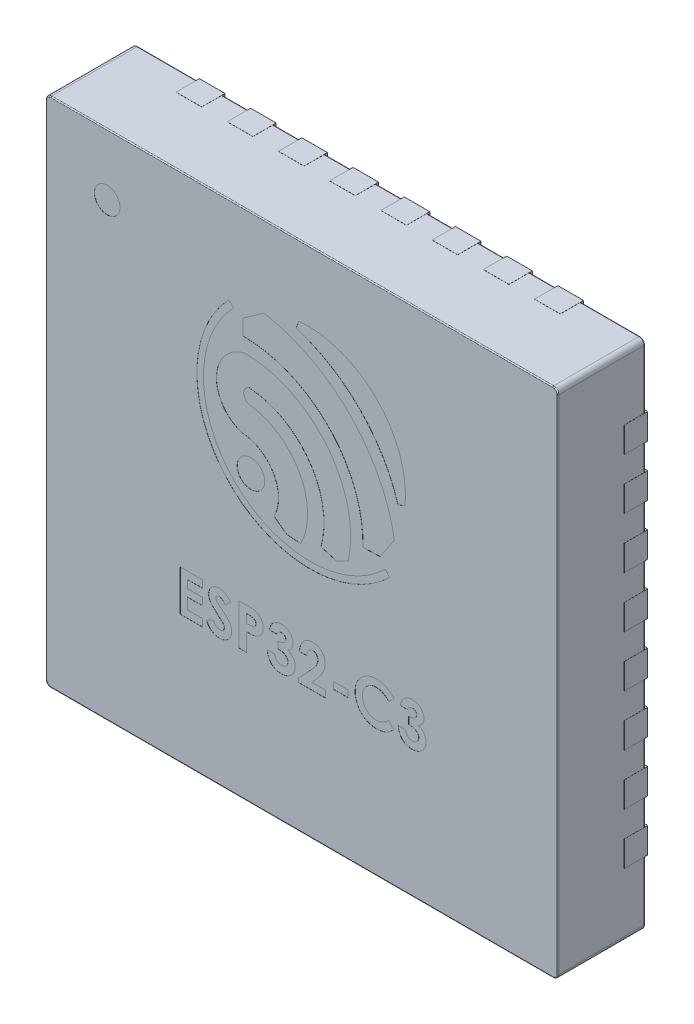
from build123d import *

# Parameters (mm, degrees)
SKETCH1_W                = 5
SKETCH1_H                = 5
BOSS_EXTRUDE1_DEPTH      = 0.85
FILLET1_R                = 0.05
FILLET2_R                = 0.01
BOSS_EXTRUDE2_DEPTH      = 0.025
BOSS_EXTRUDE2_DEPTH_BACK = 0.203
SKETCH2_W                = 0.25
SKETCH2_H                = 0.4
SKETCH2_W_2              = 0.4
SKETCH2_H_2              = 0.25
SKETCH3_R                = 0.125
SKETCH3_R_2              = 0.134340001
SKETCH3_W                = 0.138461539
SKETCH3_H                = 0.066666666
CUT_EXTRUDE1_DEPTH       = 0.001
BODY_MOVE_COPY1_ANGLE    = 180


with BuildPart() as part:
    # Sketch1 → Boss-Extrude1 (new body)
    with BuildSketch(Plane(origin=(0, 0, 0), x_dir=(1, 0, 0), z_dir=(0, 1, 0))):
        Rectangle(SKETCH1_W, SKETCH1_H)
    extrude(amount=BOSS_EXTRUDE1_DEPTH)

    # Fillet1
    fillet1_edges = [part.edges().sort_by_distance(p)[0] for p in [
        (2.5, 0.425, 2.5),
        (-2.5, 0.425, 2.5),
        (-2.5, 0.425, -2.5),
        (2.5, 0.425, -2.5),
    ]]
    fillet(fillet1_edges, radius=FILLET1_R)

    # Fillet2
    fillet2_edges = [part.edges().sort_by_distance(p)[0] for p in [
        (0, 0, -2.5),
        (0, 0.85, -2.5),
        (2.5, 0, 0),
        (0, 0, 2.5),
        (-2.5, 0, 0),
        (-2.485355339, 0, -2.485355339),
        (-2.485355339, 0, 2.485355339),
        (2.485355339, 0, 2.485355339),
        (2.485355339, 0, -2.485355339),
        (2.5, 0.85, 0),
        (-2.5, 0.85, 0),
        (0, 0.85, 2.5),
        (-2.485355339, 0.85, -2.485355339),
        (-2.485355339, 0.85, 2.485355339),
        (2.485355339, 0.85, 2.485355339),
        (2.485355339, 0.85, -2.485355339),
    ]]
    fillet(fillet2_edges, radius=FILLET2_R)

    # Sketch2 → Boss-Extrude2 (add, two sides: drawn at the far end of the back side and taken through both)
    with BuildSketch(Plane.XZ.offset(-BOSS_EXTRUDE2_DEPTH_BACK)):
        with BuildLine():
            Line((1.55732233, 1.84267767), (1.84267767, 1.55732233))
            ThreePointArc((1.84267767, 1.55732233), (1.848096988, 1.549211747), (1.85, 1.539644661))
            Line((1.85, 1.539644661), (1.85, -1.825))
            ThreePointArc((1.85, -1.825), (1.84267767, -1.84267767), (1.825, -1.85))
            Line((1.825, -1.85), (-1.825, -1.85))
            ThreePointArc((-1.825, -1.85), (-1.84267767, -1.84267767), (-1.85, -1.825))
            Line((-1.85, -1.825), (-1.85, 1.825))
            ThreePointArc((-1.85, 1.825), (-1.84267767, 1.84267767), (-1.825, 1.85))
            Line((-1.825, 1.85), (1.539644661, 1.85))
            ThreePointArc((1.539644661, 1.85), (1.549211747, 1.848096988), (1.55732233, 1.84267767))
        make_face()
        with Locations((-0.25, 2.301)):
            Rectangle(SKETCH2_W, SKETCH2_H)
        with Locations((-0.75, 2.301)):
            Rectangle(SKETCH2_W, SKETCH2_H)
        with Locations((-1.25, 2.301)):
            Rectangle(SKETCH2_W, SKETCH2_H)
        with Locations((-1.75, 2.301)):
            Rectangle(SKETCH2_W, SKETCH2_H)
        with Locations((1.75, 2.301)):
            Rectangle(SKETCH2_W, SKETCH2_H)
        with Locations((1.25, 2.301)):
            Rectangle(SKETCH2_W, SKETCH2_H)
        with Locations((0.75, 2.301)):
            Rectangle(SKETCH2_W, SKETCH2_H)
        with Locations((0.25, 2.301)):
            Rectangle(SKETCH2_W, SKETCH2_H)
        with Locations((0.25, -2.301)):
            Rectangle(SKETCH2_W, SKETCH2_H)
        with Locations((0.75, -2.301)):
            Rectangle(SKETCH2_W, SKETCH2_H)
        with Locations((1.25, -2.301)):
            Rectangle(SKETCH2_W, SKETCH2_H)
        with Locations((1.75, -2.301)):
            Rectangle(SKETCH2_W, SKETCH2_H)
        with Locations((-1.75, -2.301)):
            Rectangle(SKETCH2_W, SKETCH2_H)
        with Locations((-1.25, -2.301)):
            Rectangle(SKETCH2_W, SKETCH2_H)
        with Locations((-0.75, -2.301)):
            Rectangle(SKETCH2_W, SKETCH2_H)
        with Locations((-0.25, -2.301)):
            Rectangle(SKETCH2_W, SKETCH2_H)
        with Locations((2.301, 0.25)):
            Rectangle(SKETCH2_W_2, SKETCH2_H_2)
        with Locations((2.301, 0.75)):
            Rectangle(SKETCH2_W_2, SKETCH2_H_2)
        with Locations((2.301, 1.25)):
            Rectangle(SKETCH2_W_2, SKETCH2_H_2)
        with Locations((2.301, 1.75)):
            Rectangle(SKETCH2_W_2, SKETCH2_H_2)
        with Locations((2.301, -1.75)):
            Rectangle(SKETCH2_W_2, SKETCH2_H_2)
        with Locations((2.301, -1.25)):
            Rectangle(SKETCH2_W_2, SKETCH2_H_2)
        with Locations((2.301, -0.75)):
            Rectangle(SKETCH2_W_2, SKETCH2_H_2)
        with Locations((2.301, -0.25)):
            Rectangle(SKETCH2_W_2, SKETCH2_H_2)
        with Locations((-2.301, -0.25)):
            Rectangle(SKETCH2_W_2, SKETCH2_H_2)
        with Locations((-2.301, -0.75)):
            Rectangle(SKETCH2_W_2, SKETCH2_H_2)
        with Locations((-2.301, -1.25)):
            Rectangle(SKETCH2_W_2, SKETCH2_H_2)
        with Locations((-2.301, -1.75)):
            Rectangle(SKETCH2_W_2, SKETCH2_H_2)
        with Locations((-2.301, 1.75)):
            Rectangle(SKETCH2_W_2, SKETCH2_H_2)
        with Locations((-2.301, 1.25)):
            Rectangle(SKETCH2_W_2, SKETCH2_H_2)
        with Locations((-2.301, 0.75)):
            Rectangle(SKETCH2_W_2, SKETCH2_H_2)
        with Locations((-2.301, 0.25)):
            Rectangle(SKETCH2_W_2, SKETCH2_H_2)
    extrude(amount=BOSS_EXTRUDE2_DEPTH + BOSS_EXTRUDE2_DEPTH_BACK)

    # Sketch3 → Cut-Extrude1 (cut)
    # profile 1 of 14: a face of its own
    with BuildSketch(Plane(origin=(0, 0.85, 0), x_dir=(1, 0, 0), z_dir=(0, 1, 0))):
        with Locations(Location((1.9, -1.9, 0), (0, 0, 270))):
            Circle(SKETCH3_R)
    # profile 2 of 14: a face of its own
    with BuildSketch(Plane(origin=(0, 0.85, 0), x_dir=(1, 0, 0), z_dir=(0, 1, 0))):
        with Locations(Location((0.496495742, -0.288773597, 0), (0, 0, 270))):
            Circle(SKETCH3_R_2)
    # profile 3 of 14: a face of its own
    with BuildSketch(Plane(origin=(0, 0.85, 0), x_dir=(1, 0, 0), z_dir=(0, 1, 0))):
        with BuildLine():
            Line((-0.938884258, -0.740862042), (-1.007914258, -0.770262042))
            ThreePointArc((-1.007914258, -0.770262042), (-0.731977732, -1.532346858), (0.028674412, -1.812208514))
            Line((0.028674412, -1.812208514), (0.054985742, -1.738872042))
            ThreePointArc((0.054985742, -1.738872042), (-0.566371663, -1.363773312), (-0.938884258, -0.740862042))
        make_face()
    # profile 4 of 14: a face of its own
    with BuildSketch(Plane(origin=(0, 0.85, 0), x_dir=(1, 0, 0), z_dir=(0, 1, 0))):
        with BuildLine():
            Line((-0.595984259, -0.210971238), (-0.766114259, -0.218261238))
            Line((-0.766114259, -0.218261238), (-0.903604259, -0.428171238))
            ThreePointArc((-0.903604259, -0.428171238), (-0.469528196, -1.269267805), (0.368267697, -1.709680686))
            Line((0.368267697, -1.709680686), (0.574667697, -1.564870686))
            Line((0.574667697, -1.564870686), (0.574667697, -1.412740686))
            ThreePointArc((0.574667697, -1.412740686), (-0.264532199, -1.059156307), (-0.595984259, -0.210971238))
        make_face()
    # profile 5 of 14: a face of its own
    with BuildSketch(Plane(origin=(0, 0.85, 0), x_dir=(1, 0, 0), z_dir=(0, 1, 0))):
        with BuildLine():
            Line((0.665095742, -1.605372042), (0.713185742, -1.647912042))
            ThreePointArc((0.713185742, -1.647912042), (0.698213309, -0.092994976), (-0.856767159, -0.087798687))
            Line((-0.856767159, -0.087798687), (-0.81400017, -0.135693763))
            ThreePointArc((-0.81400017, -0.135693763), (0.652967983, -0.13845143), (0.665095742, -1.605372042))
        make_face()
    # profile 6 of 14: a face of its own
    with BuildSketch(Plane(origin=(0, 0.85, 0), x_dir=(1, 0, 0), z_dir=(0, 1, 0))):
        with BuildLine():
            Line((0.270628145, -0.040897858), (0.152248145, 0.048682142))
            Line((0.152248145, 0.048682142), (0.010108145, 0.061192142))
            ThreePointArc((0.010108145, 0.061192142), (0.023063532, -0.533305093), (0.517018452, -0.864369047))
            ThreePointArc((0.517018452, -0.864369047), (0.56730634, -0.935868301), (0.514364466, -1.005425277))
            ThreePointArc((0.514364466, -1.005425277), (-0.073942865, -0.676163273), (-0.186090772, -0.011376216))
            Line((-0.186090772, -0.011376216), (-0.336330772, 0.033353784))
            Line((-0.336330772, 0.033353784), (-0.453378748, -0.025230137))
            ThreePointArc((-0.453378748, -0.025230137), (-0.246890146, -0.892485919), (0.557429228, -1.276986216))
            ThreePointArc((0.557429228, -1.276986216), (0.833401793, -0.944715678), (0.586918034, -0.590018168))
            ThreePointArc((0.586918034, -0.590018168), (0.277806513, -0.402413824), (0.270628145, -0.040897858))
        make_face()
    # profile 7 of 14: a face of its own
    with BuildSketch(Plane(origin=(0, 0.85, 0), x_dir=(1, 0, 0), z_dir=(0, 1, 0))):
        with BuildLine():
            Line((-1.033333333, 0.942435897), (-0.961538462, 0.942435897))
            add(Edge.make_bspline(
                [(-0.961538462, 0.942435897), (-0.962042198, 0.938846343), (-0.963026121, 0.931835054), (-0.965444874, 0.921660172), (-0.968242016, 0.91198461), (-0.971819164, 0.902860293), (-0.975948336, 0.894297058), (-0.980763511, 0.886287242), (-0.986041261, 0.878715897), (-0.99017341, 0.874178624), (-0.992227564, 0.871923077)],
                knots=[0, 0, 0, 0, 1.1115466, 2.171125598, 3.205689823, 4.19946166, 5.17440286, 6.118867946, 7.064860634, 8, 8, 8, 8], degree=3))
            add(Edge.make_bspline(
                [(-0.992227564, 0.871923077), (-0.995183102, 0.868942445), (-1.001008157, 0.863067932), (-1.010742506, 0.85554333), (-1.020945902, 0.849031298), (-1.031822978, 0.843868513), (-1.043204479, 0.839689836), (-1.055180914, 0.836883009), (-1.067703343, 0.835020655), (-1.076248325, 0.834837207), (-1.080608974, 0.83474359)],
                knots=[0, 0, 0, 0, 1.01925491, 2.00884431, 2.983262333, 3.955970413, 4.92937149, 5.924503185, 6.940838805, 8, 8, 8, 8], degree=3))
            add(Edge.make_bspline(
                [(-1.080608974, 0.83474359), (-1.084485816, 0.834835114), (-1.092106905, 0.835015033), (-1.103307989, 0.836459325), (-1.113987285, 0.838992453), (-1.124257677, 0.84230446), (-1.13396812, 0.846810999), (-1.143332933, 0.852042132), (-1.152090464, 0.858458334), (-1.160261203, 0.865707996), (-1.167767585, 0.873549216), (-1.174268144, 0.881930835), (-1.179856792, 0.89062896), (-1.184461099, 0.899715858), (-1.188001185, 0.909206904), (-1.190458109, 0.919047269), (-1.192066226, 0.929215241), (-1.192226437, 0.936126274), (-1.192307692, 0.93963141)],
                knots=[0, 0, 0, 0, 1.091422571, 2.145516843, 3.172569842, 4.178562979, 5.178154469, 6.181868002, 7.194278174, 8.227918432, 9.254613415, 10.245994977, 11.209837596, 12.161663635, 13.10878368, 14.055455738, 15.013766427, 16, 16, 16, 16], degree=3))
            add(Edge.make_bspline(
                [(-1.192307692, 0.93963141), (-1.192137741, 0.943971459), (-1.191802133, 0.952541855), (-1.18914797, 0.965060586), (-1.184881252, 0.97700354), (-1.178814612, 0.988229211), (-1.171196237, 0.998725904), (-1.161853743, 1.008127017), (-1.151047843, 1.016578144), (-1.142935936, 1.021119837), (-1.138782051, 1.023445513)],
                knots=[0, 0, 0, 0, 0.992776698, 1.96045919, 2.915875678, 3.886951799, 4.871409521, 5.874469288, 6.911574252, 8, 8, 8, 8], degree=3))
            add(Edge.make_bspline(
                [(-1.138782051, 1.023445513), (-1.14163332, 1.02438149), (-1.147235936, 1.026220644), (-1.155197776, 1.029845073), (-1.162774807, 1.033797557), (-1.169793745, 1.03841166), (-1.176447069, 1.043367566), (-1.182524276, 1.048931741), (-1.188182733, 1.054961359), (-1.193282457, 1.061520567), (-1.197841847, 1.068500307), (-1.201859993, 1.075775128), (-1.205231973, 1.08337162), (-1.208062059, 1.091233959), (-1.210221336, 1.099439522), (-1.211740465, 1.107960503), (-1.212618845, 1.11677637), (-1.212752787, 1.122749155), (-1.212820513, 1.125769231)],
                knots=[0, 0, 0, 0, 1.059375415, 2.081625174, 3.086260357, 4.075579879, 5.045586876, 6.014170127, 6.982201689, 7.963705737, 8.945119069, 9.924852636, 10.896327119, 11.878239286, 12.873838556, 13.889973282, 14.933087432, 16, 16, 16, 16], degree=3))
            add(Edge.make_bspline(
                [(-1.212820513, 1.125769231), (-1.212694972, 1.130209463), (-1.212447326, 1.138968417), (-1.21055697, 1.151827447), (-1.207520743, 1.164153387), (-1.203254925, 1.175961772), (-1.197669631, 1.187217141), (-1.19092374, 1.197995179), (-1.182934833, 1.208211196), (-1.173824039, 1.217774681), (-1.163790901, 1.226551231), (-1.152982742, 1.234297881), (-1.141392774, 1.240685662), (-1.129297456, 1.24614502), (-1.116425313, 1.250196849), (-1.102942584, 1.253164024), (-1.088750888, 1.254969352), (-1.07906516, 1.255159368), (-1.07411859, 1.25525641)],
                knots=[0, 0, 0, 0, 1.005301618, 1.9830924, 2.936709333, 3.876255674, 4.820386332, 5.77704884, 6.75110905, 7.752325838, 8.764085485, 9.766124222, 10.757295257, 11.756573224, 12.766631673, 13.80722022, 14.880131728, 16, 16, 16, 16], degree=3))
            add(Edge.make_bspline(
                [(-1.07411859, 1.25525641), (-1.069439099, 1.255154355), (-1.060288975, 1.254954801), (-1.046905262, 1.253226741), (-1.034184329, 1.250441166), (-1.022098277, 1.246507988), (-1.010698559, 1.241440517), (-0.999918762, 1.235323995), (-0.989876567, 1.227971012), (-0.980525742, 1.219555051), (-0.97194556, 1.210242893), (-0.964467596, 1.199958636), (-0.957959797, 1.188926998), (-0.952379211, 1.177124255), (-0.948018978, 1.164445096), (-0.944551401, 1.151002751), (-0.942137273, 1.136739093), (-0.941401023, 1.126926236), (-0.941025641, 1.121923077)],
                knots=[0, 0, 0, 0, 1.066693477, 2.085777942, 3.071407889, 4.032495163, 4.978645371, 5.911608997, 6.853298848, 7.810770565, 8.776420673, 9.735131334, 10.704462168, 11.693492242, 12.70668109, 13.756973703, 14.856375978, 16, 16, 16, 16], degree=3))
            Line((-0.941025641, 1.121923077), (-1.012820513, 1.121923077))
            add(Edge.make_bspline(
                [(-1.012820513, 1.121923077), (-1.013275558, 1.124438726), (-1.014161878, 1.129338611), (-1.015889028, 1.136433254), (-1.018145665, 1.142979471), (-1.020725671, 1.149025354), (-1.02357817, 1.154632952), (-1.026986411, 1.159652307), (-1.030640803, 1.164280679), (-1.036134185, 1.169600682), (-1.043798713, 1.175179829), (-1.054176032, 1.180120978), (-1.065772479, 1.182931195), (-1.073863103, 1.183280826), (-1.078044872, 1.183461538)],
                knots=[0, 0, 0, 0, 0.928450228, 1.808400301, 2.64896863, 3.43999153, 4.194978884, 4.9294959, 5.640047715, 6.332896648, 7.70085756, 9.063442004, 10.482192841, 12, 12, 12, 12], degree=3))
            add(Edge.make_bspline(
                [(-1.078044872, 1.183461538), (-1.080264208, 1.183423349), (-1.08461139, 1.183348543), (-1.090997802, 1.182524115), (-1.097077749, 1.181156492), (-1.10291474, 1.17932077), (-1.108429159, 1.176900033), (-1.113691505, 1.174021296), (-1.118608143, 1.170521673), (-1.123194559, 1.166575346), (-1.127345304, 1.162229748), (-1.131099425, 1.157690483), (-1.134112475, 1.152772074), (-1.136613552, 1.147669029), (-1.138676639, 1.142382668), (-1.139971016, 1.136792708), (-1.140940093, 1.131011193), (-1.140996841, 1.127055615), (-1.141025641, 1.125048077)],
                knots=[0, 0, 0, 0, 1.110416125, 2.175056767, 3.216269732, 4.226816172, 5.232753079, 6.226173397, 7.223992381, 8.247806573, 9.250094092, 10.229378924, 11.190237183, 12.128982156, 13.072570213, 14.022671385, 14.996464856, 16, 16, 16, 16], degree=3))
            add(Edge.make_bspline(
                [(-1.141025641, 1.125048077), (-1.140952515, 1.122851746), (-1.140807811, 1.118505625), (-1.139534428, 1.112136593), (-1.137628362, 1.105986373), (-1.134887085, 1.100105709), (-1.131300003, 1.094529185), (-1.126938478, 1.089210618), (-1.121763055, 1.084192351), (-1.115947047, 1.079328232), (-1.109255785, 1.075070205), (-1.101959476, 1.071149199), (-1.093878367, 1.068027112), (-1.085206325, 1.065239191), (-1.075780297, 1.063202767), (-1.065658529, 1.061724174), (-1.054857433, 1.060623576), (-1.047412093, 1.060465678), (-1.043589744, 1.060384615)],
                knots=[0, 0, 0, 0, 0.809868251, 1.602574917, 2.388262527, 3.182133002, 3.988875265, 4.829537611, 5.714850619, 6.646378958, 7.622533229, 8.636771727, 9.698525113, 10.814716514, 11.996253919, 13.252421425, 14.589425562, 16, 16, 16, 16], degree=3))
            Line((-1.043589744, 1.060384615), (-1.043589744, 0.993717949))
            add(Edge.make_bspline(
                [(-1.043589744, 0.993717949), (-1.048349273, 0.993313795), (-1.057253411, 0.992557704), (-1.069605838, 0.990770797), (-1.080060271, 0.988434494), (-1.088729088, 0.98544169), (-1.096034957, 0.981929466), (-1.102254725, 0.977762541), (-1.107791868, 0.973148648), (-1.11231255, 0.967849105), (-1.115965677, 0.962254859), (-1.118552361, 0.956381315), (-1.120269431, 0.950359048), (-1.120432179, 0.946239806), (-1.120512821, 0.944198718)],
                knots=[0, 0, 0, 0, 1.700278244, 3.18088388, 4.44026007, 5.507838349, 6.439172496, 7.317391478, 8.167251366, 8.996486918, 9.787781501, 10.536992524, 11.275078289, 12, 12, 12, 12], degree=3))
            add(Edge.make_bspline(
                [(-1.120512821, 0.944198718), (-1.120376899, 0.941592848), (-1.12011161, 0.936506741), (-1.117955469, 0.92924541), (-1.114452349, 0.922665192), (-1.109520047, 0.916992941), (-1.103485264, 0.912309618), (-1.096455021, 0.908896094), (-1.088548513, 0.906854285), (-1.082998542, 0.90664612), (-1.080128205, 0.906538462)],
                knots=[0, 0, 0, 0, 1.008776249, 1.968917671, 2.909425455, 3.878736958, 4.86052431, 5.85160606, 6.888892716, 8, 8, 8, 8], degree=3))
            add(Edge.make_bspline(
                [(-1.080128205, 0.906538462), (-1.077526695, 0.90666622), (-1.072364501, 0.906919731), (-1.064818876, 0.908820291), (-1.057661301, 0.911987306), (-1.051075337, 0.916434693), (-1.045077182, 0.921720953), (-1.040047852, 0.927931041), (-1.035953665, 0.934822059), (-1.034210201, 0.939888002), (-1.033333333, 0.942435897)],
                knots=[0, 0, 0, 0, 0.988439209, 1.961366134, 2.938893463, 3.950078543, 4.971412263, 5.967491143, 6.977757845, 8, 8, 8, 8], degree=3))
        make_face()
    # profile 8 of 14: a face of its own
    with BuildSketch(Plane(origin=(0, 0.85, 0), x_dir=(1, 0, 0), z_dir=(0, 1, 0))):
        with BuildLine():
            Line((-0.9, 0.914391026), (-0.847355769, 0.964711538))
            add(Edge.make_bspline(
                [(-0.847355769, 0.964711538), (-0.842895255, 0.960087254), (-0.834168289, 0.951039873), (-0.820038996, 0.939195867), (-0.805513503, 0.929129948), (-0.790551153, 0.920925509), (-0.775160542, 0.9144144), (-0.759314892, 0.909872253), (-0.74305248, 0.907012248), (-0.73206307, 0.906697268), (-0.726522436, 0.906538462)],
                knots=[0, 0, 0, 0, 1.115370381, 2.182214363, 3.196266025, 4.180416361, 5.141116029, 6.092551847, 7.038303877, 8, 8, 8, 8], degree=3))
            add(Edge.make_bspline(
                [(-0.726522436, 0.906538462), (-0.721895948, 0.906666384), (-0.712766083, 0.906918825), (-0.699362316, 0.908773928), (-0.686536059, 0.911916712), (-0.674277135, 0.916285159), (-0.662524936, 0.921786498), (-0.651388895, 0.928701284), (-0.640809167, 0.936798729), (-0.630909365, 0.946064663), (-0.621971986, 0.956263287), (-0.61391928, 0.967004267), (-0.60724928, 0.978477584), (-0.601804566, 0.990515922), (-0.597514006, 1.003123628), (-0.594468824, 1.016300071), (-0.592704444, 1.030075002), (-0.592441386, 1.039439437), (-0.592307692, 1.044198718)],
                knots=[0, 0, 0, 0, 1.035268443, 2.04298821, 3.02163646, 3.985902049, 4.951223231, 5.920091634, 6.913651787, 7.92868536, 8.949353712, 9.945284791, 10.92850487, 11.913014323, 12.897904816, 13.904240668, 14.934873455, 16, 16, 16, 16], degree=3))
            add(Edge.make_bspline(
                [(-0.592307692, 1.044198718), (-0.592346771, 1.047539017), (-0.592423797, 1.054122814), (-0.593245704, 1.063837055), (-0.594610694, 1.073282546), (-0.5965252, 1.082431302), (-0.5989354, 1.091322788), (-0.601885255, 1.09989909), (-0.605451913, 1.108171212), (-0.609443596, 1.116182483), (-0.613899167, 1.123865023), (-0.618893658, 1.131116952), (-0.624371102, 1.137881919), (-0.630112326, 1.144395323), (-0.636497559, 1.150275989), (-0.643240913, 1.155848008), (-0.650439141, 1.160973342), (-0.658083501, 1.165580665), (-0.665945818, 1.16987461), (-0.674187204, 1.17343055), (-0.682577361, 1.176627128), (-0.691263481, 1.179031916), (-0.700092559, 1.181123574), (-0.709187487, 1.182401014), (-0.71846195, 1.1833717), (-0.724730207, 1.183431463), (-0.727884615, 1.183461538)],
                knots=[0, 0, 0, 0, 1.103833241, 2.175677997, 3.219414644, 4.256521947, 5.263082927, 6.262573145, 7.25136242, 8.238376666, 9.219530388, 10.184343756, 11.145312504, 12.095474572, 13.051075647, 14.010745898, 14.985684176, 15.968306307, 16.959653902, 17.943861036, 18.93268972, 19.924626761, 20.920484516, 21.929288403, 22.957944781, 24, 24, 24, 24], degree=3))
            add(Edge.make_bspline(
                [(-0.727884615, 1.183461538), (-0.733235127, 1.183307127), (-0.743747492, 1.183003748), (-0.759173624, 1.180621014), (-0.773915511, 1.176719189), (-0.785671108, 1.172026059), (-0.794869304, 1.167463667), (-0.801868158, 1.163303994), (-0.809074949, 1.158592256), (-0.816440334, 1.153197932), (-0.824004183, 1.147185216), (-0.831636554, 1.140428435), (-0.83953179, 1.133148347), (-0.844703921, 1.127952479), (-0.847355769, 1.125288462)],
                knots=[0, 0, 0, 0, 1.404640003, 2.759752344, 4.088613405, 5.401587939, 6.076032573, 6.783413463, 7.538272532, 8.336594406, 9.180107851, 10.074881764, 11.012956238, 12, 12, 12, 12], degree=3))
            Line((-0.847355769, 1.125288462), (-0.898397436, 1.178894231))
            add(Edge.make_bspline(
                [(-0.898397436, 1.178894231), (-0.894809482, 1.182358288), (-0.887806562, 1.189119388), (-0.877242851, 1.198719516), (-0.866692438, 1.207346306), (-0.856410186, 1.215312835), (-0.846227705, 1.222387153), (-0.836145924, 1.228575852), (-0.826279499, 1.234037111), (-0.816421697, 1.238673075), (-0.806494266, 1.242634613), (-0.796284288, 1.245975579), (-0.785786884, 1.248892013), (-0.774915114, 1.251187096), (-0.763717488, 1.253055453), (-0.752158023, 1.254290021), (-0.740290729, 1.255146117), (-0.73226654, 1.255219346), (-0.728205128, 1.25525641)],
                knots=[0, 0, 0, 0, 1.244537013, 2.429070097, 3.56066612, 4.644477994, 5.67429546, 6.652817684, 7.595405349, 8.486886006, 9.369351459, 10.26090686, 11.166404474, 12.086719576, 13.0323422, 13.998023148, 14.9867073, 16, 16, 16, 16], degree=3))
            add(Edge.make_bspline(
                [(-0.728205128, 1.25525641), (-0.720745106, 1.255065903), (-0.706147915, 1.254693134), (-0.68475405, 1.251940675), (-0.664413592, 1.247295761), (-0.645089992, 1.240815815), (-0.626842388, 1.23240164), (-0.609613555, 1.222192005), (-0.593432184, 1.210090009), (-0.578437515, 1.196275963), (-0.564878373, 1.181016298), (-0.552880114, 1.164637883), (-0.542998806, 1.147023101), (-0.534615023, 1.12854927), (-0.528332652, 1.108927574), (-0.52375964, 1.088335318), (-0.520976985, 1.066684132), (-0.520669593, 1.051899323), (-0.520512821, 1.044358974)],
                knots=[0, 0, 0, 0, 1.07798487, 2.109316747, 3.111276023, 4.08905949, 5.049398091, 6.009992678, 6.978127636, 7.964347882, 8.951383687, 9.924270623, 10.892397886, 11.86520058, 12.851549246, 13.863953586, 14.910602472, 16, 16, 16, 16], degree=3))
            add(Edge.make_bspline(
                [(-0.520512821, 1.044358974), (-0.52058129, 1.039441432), (-0.52071698, 1.029696066), (-0.52205466, 1.015303125), (-0.524106718, 1.001330814), (-0.527027278, 0.987796318), (-0.530658608, 0.974652775), (-0.535280765, 0.961959694), (-0.54063441, 0.94964759), (-0.546884733, 0.937831201), (-0.553891011, 0.926495594), (-0.561550768, 0.915669422), (-0.570011505, 0.905460368), (-0.579192823, 0.895823781), (-0.589018414, 0.886697376), (-0.599584374, 0.878145925), (-0.610900805, 0.870224573), (-0.622852276, 0.862926811), (-0.635211256, 0.856224823), (-0.64798653, 0.850605223), (-0.660929132, 0.845644479), (-0.674126755, 0.841637578), (-0.687608448, 0.838615163), (-0.701271261, 0.836334351), (-0.715226828, 0.835057831), (-0.724596949, 0.834849004), (-0.729326923, 0.83474359)],
                knots=[0, 0, 0, 0, 1.07193642, 2.124315995, 3.14887099, 4.149444713, 5.141371803, 6.119544533, 7.092241254, 8.06650569, 9.031360777, 9.996057679, 10.955696533, 11.919602115, 12.89624813, 13.877605408, 14.880920851, 15.905674436, 16.929600311, 17.943674756, 18.946313929, 19.950355855, 20.947755382, 21.956851243, 22.968632213, 24, 24, 24, 24], degree=3))
            add(Edge.make_bspline(
                [(-0.729326923, 0.83474359), (-0.733362045, 0.834804092), (-0.741390336, 0.834924467), (-0.753346137, 0.83592615), (-0.765205012, 0.837503751), (-0.776930749, 0.839867381), (-0.788576076, 0.842729846), (-0.800092239, 0.84625563), (-0.811447481, 0.850556261), (-0.822740242, 0.855313666), (-0.833745306, 0.860729724), (-0.844367032, 0.86679194), (-0.854631737, 0.87334172), (-0.864477543, 0.880491722), (-0.873973798, 0.888136922), (-0.883110369, 0.896277065), (-0.891799585, 0.905059813), (-0.89725271, 0.911264897), (-0.9, 0.914391026)],
                knots=[0, 0, 0, 0, 0.996333415, 1.982307736, 2.96084097, 3.949129141, 4.93457382, 5.921430247, 6.92116383, 7.931890485, 8.946633814, 9.948019707, 10.950686436, 11.952094051, 12.951305284, 13.960287133, 14.972390273, 16, 16, 16, 16], degree=3))
        make_face()
    # profile 9 of 14: a face of its own
    with BuildSketch(Plane(origin=(0, 0.85, 0), x_dir=(1, 0, 0), z_dir=(0, 1, 0))):
        with Locations((-0.379487179, 1.098846154)):
            Rectangle(SKETCH3_W, SKETCH3_H)
    # profile 10 of 14: a face of its own
    with BuildSketch(Plane(origin=(0, 0.85, 0), x_dir=(1, 0, 0), z_dir=(0, 1, 0))):
        with BuildLine():
            Line((-0.048717949, 0.978333333), (0.023076923, 0.978333333))
            add(Edge.make_bspline(
                [(0.023076923, 0.978333333), (0.022766974, 0.972902374), (0.022161351, 0.962290606), (0.019749697, 0.946877627), (0.016526465, 0.932310492), (0.012187916, 0.918632998), (0.00684402, 0.905839397), (0.000361773, 0.893972067), (-0.007065288, 0.882945974), (-0.015586869, 0.872954494), (-0.024857121, 0.863971849), (-0.034852278, 0.856118985), (-0.045543947, 0.849545111), (-0.056860635, 0.844152532), (-0.068757893, 0.839837774), (-0.081355924, 0.836954528), (-0.094543568, 0.835001543), (-0.103571658, 0.834830677), (-0.108173077, 0.83474359)],
                knots=[0, 0, 0, 0, 1.198928049, 2.342633425, 3.435730849, 4.486331048, 5.502589352, 6.488331875, 7.46361919, 8.428949135, 9.378681775, 10.305958057, 11.226249248, 12.140413166, 13.066341608, 14.010670971, 14.986082777, 16, 16, 16, 16], degree=3))
            add(Edge.make_bspline(
                [(-0.108173077, 0.83474359), (-0.113823665, 0.834908269), (-0.124859785, 0.835229903), (-0.14084493, 0.838326648), (-0.155869035, 0.843096849), (-0.169783631, 0.84995776), (-0.18251579, 0.858648889), (-0.193914154, 0.869122818), (-0.204031035, 0.881251069), (-0.212532915, 0.894944996), (-0.219448024, 0.909496014), (-0.22444089, 0.924454365), (-0.227683838, 0.939518448), (-0.228032112, 0.949658233), (-0.228205128, 0.954695513)],
                knots=[0, 0, 0, 0, 1.075206757, 2.099977874, 3.089436832, 4.070080219, 5.043757236, 6.01602434, 7.009399377, 8.042659726, 9.078134622, 10.07077983, 11.041594984, 12, 12, 12, 12], degree=3))
            add(Edge.make_bspline(
                [(-0.228205128, 0.954695513), (-0.22813802, 0.957742592), (-0.228002947, 0.963875609), (-0.22706377, 0.97315637), (-0.225654819, 0.98260991), (-0.223530463, 0.992228123), (-0.22088122, 1.002013708), (-0.217667294, 1.01199594), (-0.213814185, 1.022118258), (-0.209386003, 1.032494456), (-0.204103809, 1.043158745), (-0.197950803, 1.054268824), (-0.190757204, 1.065855264), (-0.182593244, 1.077881992), (-0.173516431, 1.090442279), (-0.163388606, 1.103387367), (-0.152339482, 1.116863405), (-0.144495025, 1.125869628), (-0.140464744, 1.130496795)],
                knots=[0, 0, 0, 0, 0.728286467, 1.465860763, 2.227952348, 3.011875114, 3.818782069, 4.650637576, 5.517456182, 6.406927181, 7.346324104, 8.360844784, 9.441645378, 10.605053135, 11.834886952, 13.145197974, 14.533275831, 16, 16, 16, 16], degree=3))
            Line((-0.140464744, 1.130496795), (-0.098717949, 1.178333333))
            Line((-0.098717949, 1.178333333), (-0.233333333, 1.178333333))
            Line((-0.233333333, 1.178333333), (-0.233333333, 1.245))
            Line((-0.233333333, 1.245), (0.033333333, 1.245))
            Line((0.033333333, 1.245), (0.033333333, 1.208621795))
            Line((0.033333333, 1.208621795), (-0.085096154, 1.082580128))
            add(Edge.make_bspline(
                [(-0.085096154, 1.082580128), (-0.088525046, 1.07890349), (-0.095165794, 1.071782933), (-0.104614011, 1.061325039), (-0.11316696, 1.05140289), (-0.120633397, 1.041901421), (-0.127465064, 1.03314234), (-0.133180256, 1.024794519), (-0.138157487, 1.017093049), (-0.143356732, 1.007705263), (-0.148407935, 0.996593223), (-0.153039808, 0.983799609), (-0.155834953, 0.971563287), (-0.156223742, 0.963575561), (-0.156410256, 0.95974359)],
                knots=[0, 0, 0, 0, 1.246192343, 2.413505005, 3.49357156, 4.492416076, 5.408771964, 6.246246772, 6.999304986, 7.680960093, 8.904522682, 10.020616941, 11.0504258, 12, 12, 12, 12], degree=3))
            add(Edge.make_bspline(
                [(-0.156410256, 0.95974359), (-0.156273344, 0.956035218), (-0.156008054, 0.948849653), (-0.153020062, 0.938657963), (-0.148549288, 0.929360403), (-0.142058571, 0.921380503), (-0.134224442, 0.914765908), (-0.125119883, 0.909918813), (-0.114912059, 0.907069945), (-0.107763827, 0.906719), (-0.104086538, 0.906538462)],
                knots=[0, 0, 0, 0, 1.061596218, 2.057012874, 3.024113775, 4.006148568, 4.986025304, 5.949989669, 6.945406325, 8, 8, 8, 8], degree=3))
            add(Edge.make_bspline(
                [(-0.104086538, 0.906538462), (-0.102187179, 0.906605641), (-0.098447984, 0.906737894), (-0.092951661, 0.90761827), (-0.087721514, 0.90916984), (-0.082699329, 0.911248725), (-0.077938705, 0.914004302), (-0.07345165, 0.91740099), (-0.069190885, 0.921352471), (-0.065175954, 0.925846389), (-0.061521842, 0.930861604), (-0.058276274, 0.93635231), (-0.055592729, 0.942315101), (-0.053230038, 0.948671257), (-0.051407818, 0.955489049), (-0.050081016, 0.962727675), (-0.049072337, 0.970375356), (-0.048838227, 0.975632418), (-0.048717949, 0.978333333)],
                knots=[0, 0, 0, 0, 0.903469896, 1.778625579, 2.63899355, 3.493148037, 4.358286772, 5.247621495, 6.164656832, 7.118446693, 8.109501108, 9.111810964, 10.146451449, 11.215617525, 12.33435995, 13.498009769, 14.714554818, 16, 16, 16, 16], degree=3))
        make_face()
    # profile 11 of 14: a face of its own
    with BuildSketch(Plane(origin=(0, 0.85, 0), x_dir=(1, 0, 0), z_dir=(0, 1, 0))):
        with BuildLine():
            Line((0.243589744, 0.942435897), (0.315384615, 0.942435897))
            add(Edge.make_bspline(
                [(0.315384615, 0.942435897), (0.314880878, 0.938846343), (0.313896956, 0.931835054), (0.311478203, 0.921660172), (0.308681061, 0.91198461), (0.305103913, 0.902860293), (0.300974741, 0.894297058), (0.296159566, 0.886287242), (0.290881816, 0.878715897), (0.286749667, 0.874178624), (0.284695513, 0.871923077)],
                knots=[0, 0, 0, 0, 1.1115466, 2.171125598, 3.205689823, 4.19946166, 5.17440286, 6.118867946, 7.064860634, 8, 8, 8, 8], degree=3))
            add(Edge.make_bspline(
                [(0.284695513, 0.871923077), (0.281739975, 0.868942445), (0.27591492, 0.863067932), (0.266180571, 0.85554333), (0.255977175, 0.849031298), (0.245100099, 0.843868513), (0.233718598, 0.839689836), (0.221742163, 0.836883009), (0.209219734, 0.835020655), (0.200674752, 0.834837207), (0.196314103, 0.83474359)],
                knots=[0, 0, 0, 0, 1.01925491, 2.00884431, 2.983262333, 3.955970413, 4.92937149, 5.924503185, 6.940838805, 8, 8, 8, 8], degree=3))
            add(Edge.make_bspline(
                [(0.196314103, 0.83474359), (0.192437261, 0.834835114), (0.184816172, 0.835015033), (0.173615088, 0.836459325), (0.162935792, 0.838992453), (0.1526654, 0.84230446), (0.142954957, 0.846810999), (0.133590144, 0.852042132), (0.124832613, 0.858458334), (0.116661874, 0.865707996), (0.109155492, 0.873549216), (0.102654933, 0.881930835), (0.097066285, 0.89062896), (0.092461978, 0.899715858), (0.088921892, 0.909206904), (0.086464967, 0.919047269), (0.084856851, 0.929215241), (0.08469664, 0.936126274), (0.084615385, 0.93963141)],
                knots=[0, 0, 0, 0, 1.091422571, 2.145516843, 3.172569842, 4.178562979, 5.178154469, 6.181868002, 7.194278174, 8.227918432, 9.254613415, 10.245994977, 11.209837596, 12.161663635, 13.10878368, 14.055455738, 15.013766427, 16, 16, 16, 16], degree=3))
            add(Edge.make_bspline(
                [(0.084615385, 0.93963141), (0.084785336, 0.943971459), (0.085120944, 0.952541855), (0.087775106, 0.965060586), (0.092041824, 0.97700354), (0.098108465, 0.988229211), (0.10572684, 0.998725904), (0.115069334, 1.008127017), (0.125875234, 1.016578144), (0.133987141, 1.021119837), (0.138141026, 1.023445513)],
                knots=[0, 0, 0, 0, 0.992776698, 1.96045919, 2.915875678, 3.886951799, 4.871409521, 5.874469288, 6.911574252, 8, 8, 8, 8], degree=3))
            add(Edge.make_bspline(
                [(0.138141026, 1.023445513), (0.135289756, 1.02438149), (0.12968714, 1.026220644), (0.121725301, 1.029845073), (0.11414827, 1.033797557), (0.107129332, 1.03841166), (0.100476008, 1.043367566), (0.094398801, 1.048931741), (0.088740344, 1.054961359), (0.08364062, 1.061520567), (0.079081229, 1.068500307), (0.075063084, 1.075775128), (0.071691104, 1.08337162), (0.068861018, 1.091233959), (0.066701741, 1.099439522), (0.065182612, 1.107960503), (0.064304232, 1.11677637), (0.06417029, 1.122749155), (0.064102564, 1.125769231)],
                knots=[0, 0, 0, 0, 1.059375415, 2.081625174, 3.086260357, 4.075579879, 5.045586876, 6.014170127, 6.982201689, 7.963705737, 8.945119069, 9.924852636, 10.896327119, 11.878239286, 12.873838556, 13.889973282, 14.933087432, 16, 16, 16, 16], degree=3))
            add(Edge.make_bspline(
                [(0.064102564, 1.125769231), (0.064228105, 1.130209463), (0.064475751, 1.138968417), (0.066366107, 1.151827447), (0.069402334, 1.164153387), (0.073668152, 1.175961772), (0.079253446, 1.187217141), (0.085999337, 1.197995179), (0.093988244, 1.208211196), (0.103099038, 1.217774681), (0.113132176, 1.226551231), (0.123940335, 1.234297881), (0.135530303, 1.240685662), (0.147625621, 1.24614502), (0.160497764, 1.250196849), (0.173980493, 1.253164024), (0.188172189, 1.254969352), (0.197857917, 1.255159368), (0.202804487, 1.25525641)],
                knots=[0, 0, 0, 0, 1.005301618, 1.9830924, 2.936709333, 3.876255674, 4.820386332, 5.77704884, 6.75110905, 7.752325838, 8.764085485, 9.766124222, 10.757295257, 11.756573224, 12.766631673, 13.80722022, 14.880131728, 16, 16, 16, 16], degree=3))
            add(Edge.make_bspline(
                [(0.202804487, 1.25525641), (0.207483978, 1.255154355), (0.216634102, 1.254954801), (0.230017815, 1.253226741), (0.242738747, 1.250441166), (0.2548248, 1.246507988), (0.266224518, 1.241440517), (0.277004315, 1.235323995), (0.28704651, 1.227971012), (0.296397335, 1.219555051), (0.304977517, 1.210242893), (0.312455481, 1.199958636), (0.31896328, 1.188926998), (0.324543866, 1.177124255), (0.328904099, 1.164445096), (0.332371676, 1.151002751), (0.334785804, 1.136739093), (0.335522053, 1.126926236), (0.335897436, 1.121923077)],
                knots=[0, 0, 0, 0, 1.066693477, 2.085777942, 3.071407889, 4.032495163, 4.978645371, 5.911608997, 6.853298848, 7.810770565, 8.776420673, 9.735131334, 10.704462168, 11.693492242, 12.70668109, 13.756973703, 14.856375978, 16, 16, 16, 16], degree=3))
            Line((0.335897436, 1.121923077), (0.264102564, 1.121923077))
            add(Edge.make_bspline(
                [(0.264102564, 1.121923077), (0.263647519, 1.124438726), (0.262761199, 1.129338611), (0.261034049, 1.136433254), (0.258777412, 1.142979471), (0.256197406, 1.149025354), (0.253344907, 1.154632952), (0.249936666, 1.159652307), (0.246282274, 1.164280679), (0.240788892, 1.169600682), (0.233124364, 1.175179829), (0.222747045, 1.180120978), (0.211150598, 1.182931195), (0.203059974, 1.183280826), (0.198878205, 1.183461538)],
                knots=[0, 0, 0, 0, 0.928450228, 1.808400301, 2.64896863, 3.43999153, 4.194978884, 4.9294959, 5.640047715, 6.332896648, 7.70085756, 9.063442004, 10.482192841, 12, 12, 12, 12], degree=3))
            add(Edge.make_bspline(
                [(0.198878205, 1.183461538), (0.196658869, 1.183423349), (0.192311687, 1.183348543), (0.185925275, 1.182524115), (0.179845328, 1.181156492), (0.174008337, 1.17932077), (0.168493918, 1.176900033), (0.163231572, 1.174021296), (0.158314934, 1.170521673), (0.153728518, 1.166575346), (0.149577773, 1.162229748), (0.145823652, 1.157690483), (0.142810602, 1.152772074), (0.140309525, 1.147669029), (0.138246437, 1.142382668), (0.136952061, 1.136792708), (0.135982983, 1.131011193), (0.135926236, 1.127055615), (0.135897436, 1.125048077)],
                knots=[0, 0, 0, 0, 1.110416125, 2.175056767, 3.216269732, 4.226816172, 5.232753079, 6.226173397, 7.223992381, 8.247806573, 9.250094092, 10.229378924, 11.190237183, 12.128982156, 13.072570213, 14.022671385, 14.996464856, 16, 16, 16, 16], degree=3))
            add(Edge.make_bspline(
                [(0.135897436, 1.125048077), (0.135970562, 1.122851746), (0.136115266, 1.118505625), (0.137388649, 1.112136593), (0.139294715, 1.105986373), (0.142035992, 1.100105709), (0.145623074, 1.094529185), (0.149984599, 1.089210618), (0.155160022, 1.084192351), (0.16097603, 1.079328232), (0.167667292, 1.075070205), (0.174963601, 1.071149199), (0.18304471, 1.068027112), (0.191716752, 1.065239191), (0.20114278, 1.063202767), (0.211264548, 1.061724174), (0.222065644, 1.060623576), (0.229510984, 1.060465678), (0.233333333, 1.060384615)],
                knots=[0, 0, 0, 0, 0.809868251, 1.602574917, 2.388262527, 3.182133002, 3.988875265, 4.829537611, 5.714850619, 6.646378958, 7.622533229, 8.636771727, 9.698525113, 10.814716514, 11.996253919, 13.252421425, 14.589425562, 16, 16, 16, 16], degree=3))
            Line((0.233333333, 1.060384615), (0.233333333, 0.993717949))
            add(Edge.make_bspline(
                [(0.233333333, 0.993717949), (0.228573804, 0.993313795), (0.219669666, 0.992557704), (0.207317239, 0.990770797), (0.196862806, 0.988434494), (0.188193989, 0.98544169), (0.18088812, 0.981929466), (0.174668351, 0.977762541), (0.169131209, 0.973148648), (0.164610527, 0.967849105), (0.160957399, 0.962254859), (0.158370716, 0.956381315), (0.156653646, 0.950359048), (0.156490898, 0.946239806), (0.156410256, 0.944198718)],
                knots=[0, 0, 0, 0, 1.700278244, 3.18088388, 4.44026007, 5.507838349, 6.439172496, 7.317391478, 8.167251366, 8.996486918, 9.787781501, 10.536992524, 11.275078289, 12, 12, 12, 12], degree=3))
            add(Edge.make_bspline(
                [(0.156410256, 0.944198718), (0.156546178, 0.941592848), (0.156811467, 0.936506741), (0.158967608, 0.92924541), (0.162470728, 0.922665192), (0.16740303, 0.916992941), (0.173437812, 0.912309618), (0.180468056, 0.908896094), (0.188374564, 0.906854285), (0.193924535, 0.90664612), (0.196794872, 0.906538462)],
                knots=[0, 0, 0, 0, 1.008776249, 1.968917671, 2.909425455, 3.878736958, 4.86052431, 5.85160606, 6.888892716, 8, 8, 8, 8], degree=3))
            add(Edge.make_bspline(
                [(0.196794872, 0.906538462), (0.199396382, 0.90666622), (0.204558576, 0.906919731), (0.212104201, 0.908820291), (0.219261776, 0.911987306), (0.22584774, 0.916434693), (0.231845895, 0.921720953), (0.236875225, 0.927931041), (0.240969412, 0.934822059), (0.242712876, 0.939888002), (0.243589744, 0.942435897)],
                knots=[0, 0, 0, 0, 0.988439209, 1.961366134, 2.938893463, 3.950078543, 4.971412263, 5.967491143, 6.977757845, 8, 8, 8, 8], degree=3))
        make_face()
    # profile 12 of 14: a face of its own
    with BuildSketch(Plane(origin=(0, 0.85, 0), x_dir=(1, 0, 0), z_dir=(0, 1, 0))):
        with BuildLine():
            Line((0.612820513, 0.845), (0.532692308, 0.845))
            add(Edge.make_bspline(
                [(0.532692308, 0.845), (0.527456835, 0.845023435), (0.51735651, 0.845068646), (0.502791011, 0.845616893), (0.489353623, 0.846599381), (0.477047442, 0.84781359), (0.465877501, 0.849515835), (0.455829897, 0.85146741), (0.446902271, 0.853844722), (0.438994833, 0.856667434), (0.431895973, 0.859992389), (0.425186056, 0.86354381), (0.41896607, 0.867753469), (0.413089987, 0.872317926), (0.407602257, 0.877332141), (0.402462215, 0.882776297), (0.397722789, 0.888729512), (0.393413692, 0.895150775), (0.38950253, 0.901909353), (0.386086045, 0.909020659), (0.383314639, 0.916495039), (0.380989815, 0.924284388), (0.379122482, 0.9323883), (0.377879529, 0.940856632), (0.377035252, 0.94963025), (0.376960756, 0.95560158), (0.376923077, 0.958621795)],
                knots=[0, 0, 0, 0, 1.698787518, 3.27731721, 4.728409951, 6.070286353, 7.288646904, 8.393455548, 9.389990496, 10.283725379, 11.113616976, 11.931887102, 12.744353494, 13.547053751, 14.344590688, 15.153907614, 15.974148981, 16.810666655, 17.660988447, 18.506082349, 19.367288142, 20.244738011, 21.142497992, 22.06302001, 23.020302899, 24, 24, 24, 24], degree=3))
            add(Edge.make_bspline(
                [(0.376923077, 0.958621795), (0.376977357, 0.961963083), (0.377084025, 0.968529125), (0.378137611, 0.978152487), (0.379919693, 0.987333736), (0.382305403, 0.996112095), (0.385417228, 1.004468359), (0.389317387, 1.012347634), (0.393778634, 1.019848654), (0.399045314, 1.026834224), (0.404865012, 1.033339904), (0.411131497, 1.039436491), (0.418032797, 1.044873405), (0.425322583, 1.049933305), (0.433209437, 1.054319194), (0.441459687, 1.058380345), (0.450282582, 1.061826603), (0.456422396, 1.063634623), (0.459535256, 1.064551282)],
                knots=[0, 0, 0, 0, 1.101767505, 2.165108537, 3.187936629, 4.183892551, 5.162396277, 6.123736501, 7.080098904, 8.036826416, 9.0040019, 9.957275584, 10.916231297, 11.898534744, 12.880877694, 13.889532316, 14.930001539, 16, 16, 16, 16], degree=3))
            add(Edge.make_bspline(
                [(0.459535256, 1.064551282), (0.461585796, 1.06506146), (0.466027925, 1.066166668), (0.473378428, 1.067288733), (0.481849111, 1.068320402), (0.491467366, 1.069206997), (0.502238737, 1.069809675), (0.514152795, 1.070280339), (0.527214939, 1.070622561), (0.536297837, 1.070634705), (0.541025641, 1.070641026)],
                knots=[0, 0, 0, 0, 0.618981996, 1.340914327, 2.176866532, 3.120127938, 4.170906482, 5.338178032, 6.614476169, 8, 8, 8, 8], degree=3))
            Line((0.541025641, 1.070641026), (0.541025641, 1.245))
            Line((0.541025641, 1.245), (0.612820513, 1.245))
            Line((0.612820513, 1.245), (0.612820513, 0.845))
        make_face()
        with BuildLine():
            Line((0.541025641, 0.998846154), (0.515625, 0.998846154))
            add(Edge.make_bspline(
                [(0.515625, 0.998846154), (0.511002877, 0.998816956), (0.502498101, 0.99876323), (0.490884631, 0.997982188), (0.481548762, 0.996794697), (0.474181351, 0.995077659), (0.468361838, 0.992520984), (0.46340301, 0.989437369), (0.458997401, 0.985731846), (0.45532498, 0.981289502), (0.452332312, 0.97633326), (0.45023329, 0.970825696), (0.448908477, 0.964854826), (0.448782654, 0.960685695), (0.448717949, 0.958541667)],
                knots=[0, 0, 0, 0, 1.862351722, 3.426754836, 4.68713255, 5.653025869, 6.462861518, 7.236406327, 7.999926698, 8.771672214, 9.54880311, 10.322347919, 11.137246204, 12, 12, 12, 12], degree=3))
            add(Edge.make_bspline(
                [(0.448717949, 0.958541667), (0.448780637, 0.956667989), (0.448902266, 0.953032603), (0.449808106, 0.947789529), (0.451214016, 0.942911489), (0.453362676, 0.938466481), (0.455971345, 0.93435083), (0.459280766, 0.930692655), (0.463097209, 0.927373604), (0.466048621, 0.92561899), (0.467548077, 0.924727564)],
                knots=[0, 0, 0, 0, 1.102449765, 2.139017612, 3.12397484, 4.080535277, 5.035673127, 5.982361139, 6.974944601, 8, 8, 8, 8], degree=3))
            add(Edge.make_bspline(
                [(0.467548077, 0.924727564), (0.468817882, 0.924085387), (0.471506319, 0.922725767), (0.476084989, 0.92114511), (0.481368703, 0.919811651), (0.487393134, 0.918704893), (0.494134248, 0.917845934), (0.501590842, 0.917189046), (0.509773889, 0.916924885), (0.515464709, 0.916839405), (0.518429487, 0.916794872)],
                knots=[0, 0, 0, 0, 0.656809284, 1.390599849, 2.23162475, 3.173112763, 4.218524733, 5.370385145, 6.63003504, 8, 8, 8, 8], degree=3))
            Line((0.518429487, 0.916794872), (0.541025641, 0.916794872))
            Line((0.541025641, 0.916794872), (0.541025641, 0.998846154))
        make_face(mode=Mode.SUBTRACT)
    # profile 13 of 14: a face of its own
    with BuildSketch(Plane(origin=(0, 0.85, 0), x_dir=(1, 0, 0), z_dir=(0, 1, 0))):
        with BuildLine():
            Line((0.694871795, 0.898445513), (0.748557692, 0.947564103))
            add(Edge.make_bspline(
                [(0.748557692, 0.947564103), (0.750856923, 0.944319594), (0.755271127, 0.938090591), (0.762433282, 0.929758914), (0.769552648, 0.922604746), (0.776774788, 0.916832635), (0.783975359, 0.912185903), (0.791307342, 0.908980865), (0.798686387, 0.906919686), (0.803646569, 0.906664269), (0.806089744, 0.906538462)],
                knots=[0, 0, 0, 0, 1.299459705, 2.494781419, 3.587730629, 4.594196874, 5.512431013, 6.380462003, 7.202284646, 8, 8, 8, 8], degree=3))
            add(Edge.make_bspline(
                [(0.806089744, 0.906538462), (0.8083696, 0.906616), (0.812771404, 0.906765708), (0.819017273, 0.908328668), (0.824630241, 0.910854328), (0.829460795, 0.914343124), (0.83334687, 0.918509759), (0.836368526, 0.922945345), (0.838124416, 0.927781595), (0.838349907, 0.931098379), (0.838461538, 0.932740385)],
                knots=[0, 0, 0, 0, 1.184157716, 2.286297433, 3.324836695, 4.370048774, 5.362957217, 6.276446515, 7.146738784, 8, 8, 8, 8], degree=3))
            add(Edge.make_bspline(
                [(0.838461538, 0.932740385), (0.838390876, 0.934405297), (0.838248571, 0.937758201), (0.836874104, 0.942672298), (0.834802388, 0.947473943), (0.832822779, 0.950396932), (0.831810897, 0.951891026)],
                knots=[0, 0, 0, 0, 0.967525499, 1.948461899, 2.951351359, 4, 4, 4, 4], degree=3))
            add(Edge.make_bspline(
                [(0.831810897, 0.951891026), (0.830887278, 0.953048914), (0.828748943, 0.95572962), (0.82479549, 0.960043247), (0.819626114, 0.965107205), (0.813459301, 0.971176653), (0.806063624, 0.978015832), (0.797597871, 0.985822762), (0.787873688, 0.994332249), (0.781060906, 1.000339558), (0.777483974, 1.00349359)],
                knots=[0, 0, 0, 0, 0.473849886, 1.097042329, 1.870584189, 2.789244661, 3.865562256, 5.093556389, 6.47402294, 8, 8, 8, 8], degree=3))
            add(Edge.make_bspline(
                [(0.777483974, 1.00349359), (0.774118464, 1.00640478), (0.767731426, 1.011929614), (0.758655456, 1.019784124), (0.750627257, 1.02681892), (0.743719843, 1.03308668), (0.737726804, 1.03832929), (0.732913197, 1.042869282), (0.729073012, 1.046508052), (0.726892236, 1.048708389), (0.725961538, 1.049647436)],
                knots=[0, 0, 0, 0, 1.543627419, 2.929484142, 4.163674036, 5.24627963, 6.164986907, 6.925413438, 7.541394495, 8, 8, 8, 8], degree=3))
            add(Edge.make_bspline(
                [(0.725961538, 1.049647436), (0.722428487, 1.053467953), (0.715636721, 1.060812328), (0.706827123, 1.072224611), (0.699498389, 1.0832792), (0.693823035, 1.094288257), (0.689707017, 1.105479296), (0.686710702, 1.117011985), (0.6849147, 1.129051219), (0.684715924, 1.137248245), (0.684615385, 1.141394231)],
                knots=[0, 0, 0, 0, 1.206413378, 2.319150186, 3.339784753, 4.27899982, 5.184598145, 6.099639703, 7.038813909, 8, 8, 8, 8], degree=3))
            add(Edge.make_bspline(
                [(0.684615385, 1.141394231), (0.684687034, 1.145434019), (0.684827613, 1.153360233), (0.686547569, 1.164959606), (0.689003631, 1.176058649), (0.692788134, 1.186546175), (0.697439586, 1.196546467), (0.703108583, 1.20606289), (0.7100395, 1.214873272), (0.717737728, 1.223215342), (0.726385875, 1.23070322), (0.735685418, 1.23730475), (0.745654066, 1.242878587), (0.756215852, 1.247472004), (0.767503237, 1.250880826), (0.779337907, 1.253458094), (0.791839103, 1.255012065), (0.800369511, 1.255173788), (0.804727564, 1.25525641)],
                knots=[0, 0, 0, 0, 1.043039441, 2.046482205, 3.024244422, 3.976033659, 4.920890471, 5.871402525, 6.830893638, 7.812473116, 8.800703348, 9.781190227, 10.754606487, 11.746997808, 12.751247331, 13.796362838, 14.874195872, 16, 16, 16, 16], degree=3))
            add(Edge.make_bspline(
                [(0.804727564, 1.25525641), (0.808148649, 1.255195784), (0.81492436, 1.25507571), (0.824910261, 1.254093387), (0.834554585, 1.25251302), (0.843838068, 1.250230432), (0.852819435, 1.247404204), (0.861401217, 1.243729096), (0.869697515, 1.239573036), (0.877680739, 1.234756835), (0.885284736, 1.229163285), (0.89272859, 1.22301316), (0.899748411, 1.215969152), (0.906612407, 1.208288052), (0.913033902, 1.199747245), (0.919351276, 1.190603731), (0.925256195, 1.180638928), (0.928905332, 1.173649945), (0.930769231, 1.170080128)],
                knots=[0, 0, 0, 0, 1.017088714, 2.014418954, 2.980620591, 3.920647918, 4.854987948, 5.776890852, 6.693269322, 7.612671471, 8.545186947, 9.498010697, 10.480815007, 11.499174288, 12.558697099, 13.655746277, 14.802607237, 16, 16, 16, 16], degree=3))
            Line((0.930769231, 1.170080128), (0.867628205, 1.132179487))
            add(Edge.make_bspline(
                [(0.867628205, 1.132179487), (0.865296912, 1.136231832), (0.860827625, 1.144000522), (0.853254, 1.154438743), (0.845495208, 1.163377351), (0.837371872, 1.170658356), (0.82898277, 1.176379114), (0.820287379, 1.180467565), (0.811279591, 1.182998312), (0.805143895, 1.183307374), (0.802083333, 1.183461538)],
                knots=[0, 0, 0, 0, 1.283663364, 2.460892379, 3.537111102, 4.529833553, 5.449777664, 6.316464042, 7.160231139, 8, 8, 8, 8], degree=3))
            add(Edge.make_bspline(
                [(0.802083333, 1.183461538), (0.79896973, 1.183336836), (0.792928887, 1.183094895), (0.784292161, 1.180816054), (0.77633898, 1.177318334), (0.769501264, 1.172231439), (0.763694729, 1.166430899), (0.759532039, 1.159888802), (0.756831849, 1.152895383), (0.756551337, 1.1480153), (0.756410256, 1.145560897)],
                knots=[0, 0, 0, 0, 1.13537643, 2.202795631, 3.242191317, 4.290390765, 5.297919085, 6.223733717, 7.106639842, 8, 8, 8, 8], degree=3))
            add(Edge.make_bspline(
                [(0.756410256, 1.145560897), (0.756542312, 1.143278622), (0.756810571, 1.138642397), (0.758775729, 1.131745074), (0.76187365, 1.124881197), (0.765428879, 1.119191673), (0.769135396, 1.114449219), (0.772768493, 1.110401883), (0.777074341, 1.105836728), (0.782162656, 1.100878242), (0.78793447, 1.095431087), (0.79440868, 1.089508215), (0.801655007, 1.083157907), (0.806776931, 1.078832316), (0.809455128, 1.076570513)],
                knots=[0, 0, 0, 0, 0.916057066, 1.860882232, 2.859899639, 3.934694552, 4.546382938, 5.276161949, 6.118633209, 7.067046139, 8.129668089, 9.306861125, 10.591787583, 12, 12, 12, 12], degree=3))
            add(Edge.make_bspline(
                [(0.809455128, 1.076570513), (0.814546297, 1.072262613), (0.824317791, 1.06399445), (0.838128617, 1.05178505), (0.850564744, 1.04036575), (0.861543232, 1.029645194), (0.871096693, 1.019691879), (0.879330297, 1.010593185), (0.886110993, 1.002170689), (0.893142159, 0.992111015), (0.900011815, 0.980025507), (0.905850044, 0.965416936), (0.909623195, 0.950826656), (0.910047547, 0.941015082), (0.91025641, 0.936185897)],
                knots=[0, 0, 0, 0, 1.345685333, 2.582777463, 3.719355561, 4.752181389, 5.678433858, 6.502864483, 7.227563063, 7.858499643, 8.978226409, 10.023061349, 11.026965269, 12, 12, 12, 12], degree=3))
            add(Edge.make_bspline(
                [(0.91025641, 0.936185897), (0.910169504, 0.932761379), (0.909998288, 0.926014711), (0.908475542, 0.916093555), (0.906189156, 0.906524997), (0.902903478, 0.89731146), (0.898496483, 0.888556737), (0.893291016, 0.880119132), (0.887138851, 0.872024434), (0.880087816, 0.864452207), (0.872347721, 0.857491427), (0.864092157, 0.851384444), (0.855397398, 0.846220399), (0.846237078, 0.842013472), (0.836627407, 0.8387306), (0.826559507, 0.836410542), (0.816064232, 0.835027), (0.808925136, 0.834839237), (0.805288462, 0.83474359)],
                knots=[0, 0, 0, 0, 1.010806554, 1.991397492, 2.957573065, 3.913225829, 4.872777376, 5.846906201, 6.837692339, 7.870332167, 8.898170327, 9.907899016, 10.8981826, 11.879407896, 12.8797257, 13.891947133, 14.926152479, 16, 16, 16, 16], degree=3))
            add(Edge.make_bspline(
                [(0.805288462, 0.83474359), (0.800575791, 0.834916459), (0.79118765, 0.835260832), (0.777302905, 0.837939675), (0.763734189, 0.842196883), (0.752766404, 0.847211683), (0.74411462, 0.852224393), (0.737467717, 0.856745827), (0.730651389, 0.861937985), (0.723790773, 0.867951963), (0.716625711, 0.874440114), (0.709518116, 0.881847697), (0.702119939, 0.88979517), (0.697330168, 0.895511552), (0.694871795, 0.898445513)],
                knots=[0, 0, 0, 0, 1.282890948, 2.555655204, 3.837225328, 5.149160694, 5.83044799, 6.558852598, 7.337307105, 8.162686284, 9.043076448, 9.969084596, 10.957622644, 12, 12, 12, 12], degree=3))
        make_face()
    # profile 14 of 14: a face of its own
    with BuildSketch(Plane(origin=(0, 0.85, 0), x_dir=(1, 0, 0), z_dir=(0, 1, 0))):
        Polygon((1.187179487, 0.845), (0.971794872, 0.845), (0.971794872, 0.916794872), (1.115384615, 0.916794872), (1.115384615, 0.993717949), (0.971794872, 0.993717949), (0.971794872, 1.065512821), (1.115384615, 1.065512821), (1.115384615, 1.173205128), (0.971794872, 1.173205128), (0.971794872, 1.245), (1.187179487, 1.245), align=None)
    extrude(amount=-CUT_EXTRUDE1_DEPTH, mode=Mode.SUBTRACT)


with BuildPart() as part_1:
    # Body-Move/Copy1: moved
    add(part.part.rotate(Axis((0, 0, 0), (-4.937700262164522e-15, 0.7071067811865462, 0.7071067811865488)), BODY_MOVE_COPY1_ANGLE))


with BuildPart() as part_2:
    # Body-Move/Copy2: moved
    add(part_1.part.moved(Location((0, 0, 0.025))))


solid = part_2.part
